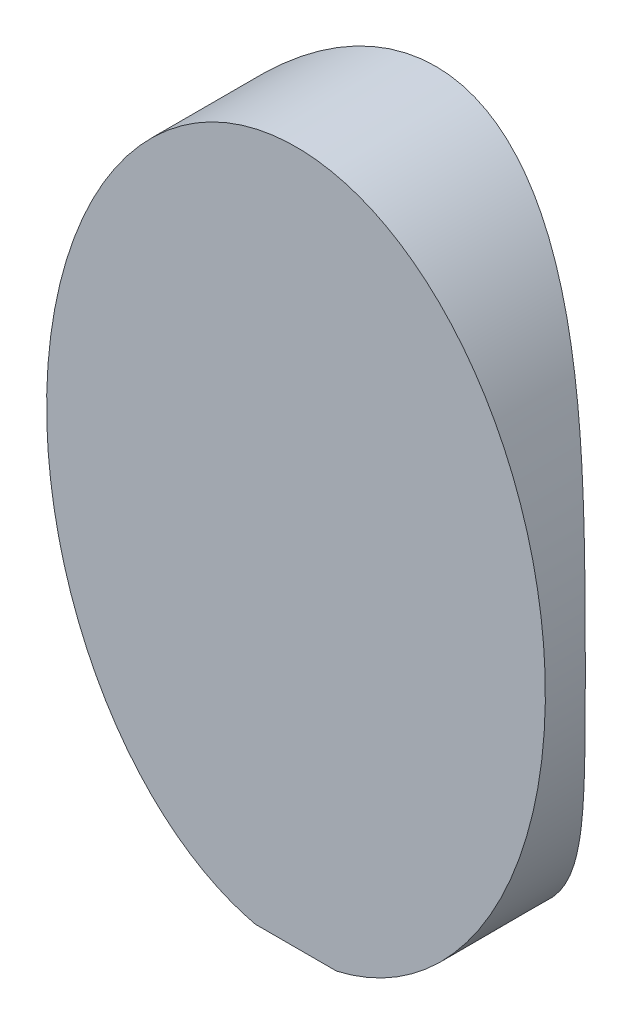
from build123d import *

# Parameters (mm, degrees)
BOSS_EXTRUDE1_DEPTH     = 0.3
CUT_EXTRUDE1_DEPTH      = 1.911043523
CUT_EXTRUDE1_DEPTH_BACK = 1.911043523


with BuildPart() as part:
    # Sketch1 → Boss-Extrude1 (new body)
    with BuildSketch(Plane.XY):
        with BuildLine():
            Line((-0.081490966, -0.690640338), (0.081490966, -0.690640338))
            add(Edge.make_bspline(
                [(0.081490966, -0.690640338), (0.837464392, -0.515808659), (0.418732196, 0.382544327), (0, 1.280897313), (-0.418732196, 0.382544327), (-0.837464392, -0.515808659), (-0.081490966, -0.690640338)],
                knots=[3.305304901, 3.305304901, 3.305304901, 5.290558505, 5.290558505, 7.275812109, 7.275812109, 9.261065714, 9.261065714, 9.261065714], degree=2, weights=[1, 0.546491895, 1, 0.546491895, 1, 0.546491895, 1]))
        make_face()
    extrude(amount=BOSS_EXTRUDE1_DEPTH)

    # Sketch2 → Cut-Extrude1 (cut, two sides: drawn at the far end of the back side and taken through both)
    with BuildSketch(Plane(origin=(0, 0, 0), x_dir=(1, 0, 0), z_dir=(0, 1, 0)).offset(-CUT_EXTRUDE1_DEPTH_BACK)):
        with BuildLine():
            Line((-0.5, -0.22), (-0.5, -0.02))
            Line((-0.5, -0.02), (-0.5, 0))
            Line((-0.5, 0), (0.5, 0))
            Line((0.5, 0), (0.5, -0.02))
            Line((0.5, -0.02), (0.5, -0.22))
            ThreePointArc((0.5, -0.22), (0, -0.02), (-0.5, -0.22))
        make_face()
    extrude(amount=CUT_EXTRUDE1_DEPTH + CUT_EXTRUDE1_DEPTH_BACK, mode=Mode.SUBTRACT)


solid = part.part
